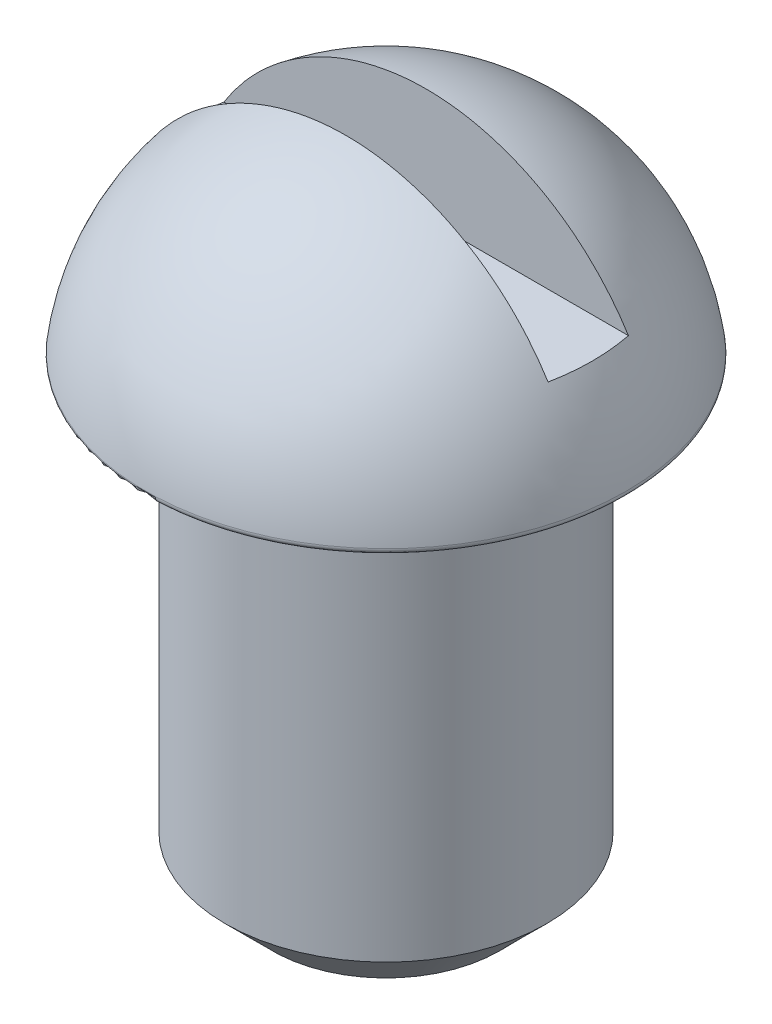
from build123d import *

# Parameters (mm, degrees)
SKETCH_13_W         = 18
SKETCH_13_H         = 3
CUT_EXTRUDE_9_DEPTH = 4.2
FILLET_1_R          = 0.2
CHAMFER_1_SIZE      = 1.75


with BuildPart() as part:
    # Эскиз1 → Повернуть1 (revolve)
    with BuildSketch(Plane.XY):
        with BuildLine():
            Line((6, 86.24931314), (9, 86.24931314))
            ThreePointArc((9, 86.24931314), (6.590344115, 91.505885748), (1.5, 94.24931314))
            Line((1.5, 94.24931314), (0, 94.24931314))
            Line((0, 94.24931314), (0, 69.24931314))
            Line((0, 69.24931314), (6, 69.24931314))
            Line((6, 69.24931314), (6, 86.24931314))
        make_face()
    revolve(axis=Axis((0, 125.763182898, 0), (0, -1, 0)))

    # Эскиз13 → Вырез-Вытянуть9 (cut)
    with BuildSketch(Plane(origin=(0, 94.24931314, 0), x_dir=(-1, 0, 0), z_dir=(0, 1, 0))):
        Rectangle(SKETCH_13_W, SKETCH_13_H)
    extrude(amount=-CUT_EXTRUDE_9_DEPTH, mode=Mode.SUBTRACT)

    # Скругление1
    fillet_1_edges = [part.edges().sort_by_distance(p)[0] for p in [
        (-9, 86.24931314, 0),
    ]]
    fillet(fillet_1_edges, radius=FILLET_1_R)

    # Фаска1
    chamfer_1_edges = [part.edges().sort_by_distance(p)[0] for p in [
        (-6, 69.24931314, 0),
    ]]
    chamfer(chamfer_1_edges, length=CHAMFER_1_SIZE)


solid = part.part
